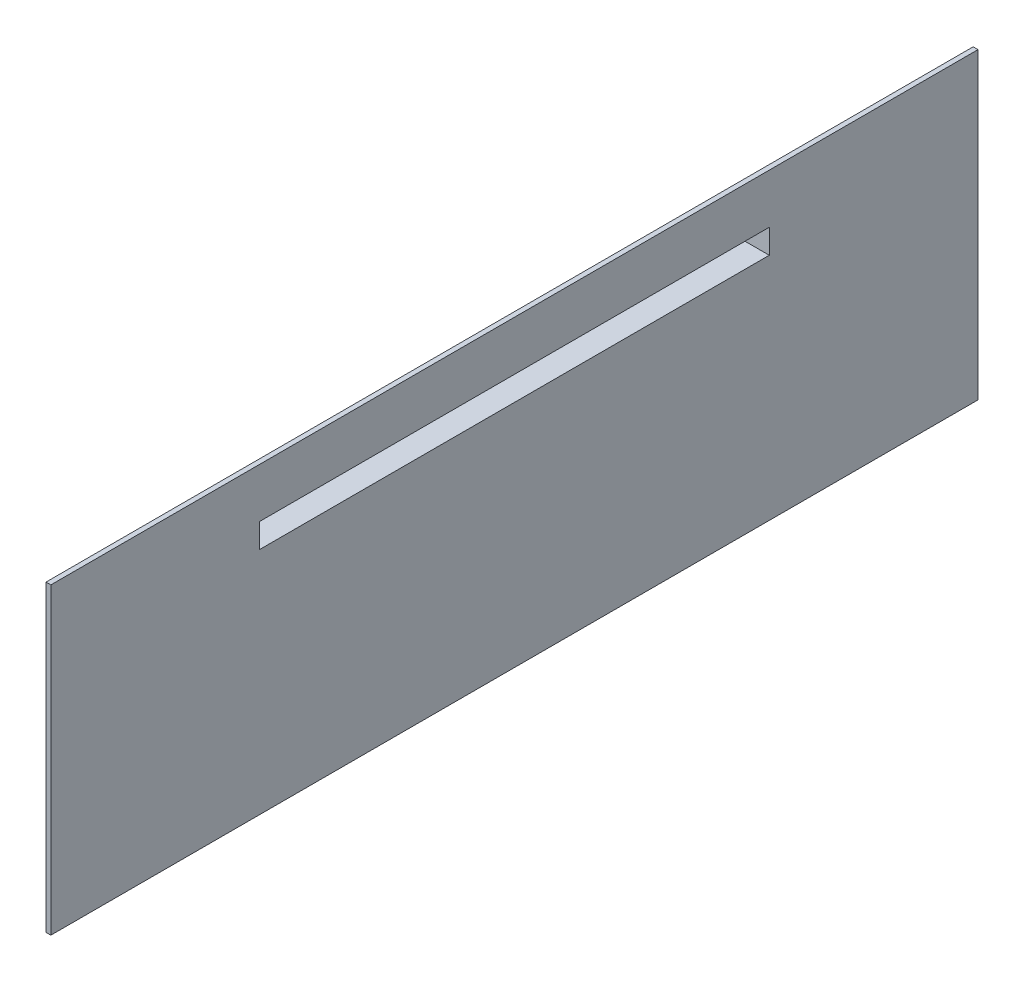
from build123d import *

# Parameters (mm, degrees)
SKETCH1_W           = 125
SKETCH1_H           = 382
BOSS_EXTRUDE1_DEPTH = 2
SKETCH2_W           = 216
SKETCH2_H           = 16
BOSS_EXTRUDE2_DEPTH = 10
SKETCH3_W           = 210
SKETCH3_H           = 10
CUT_EXTRUDE1_DEPTH  = 390.477855596


with BuildPart() as part:
    # Sketch1 → Boss-Extrude1 (new body)
    with BuildSketch(Plane(origin=(532, 0, 0), x_dir=(0, -1, 0), z_dir=(-1, 0, 0))):
        with Locations((12.5, -191)):
            Rectangle(SKETCH1_W, SKETCH1_H)
    extrude(amount=-BOSS_EXTRUDE1_DEPTH)

    # Sketch2 → Boss-Extrude2 (add)
    with BuildSketch(Plane.ZY.offset(-532)):
        with Locations((-191, 24.613657059)):
            Rectangle(SKETCH2_W, SKETCH2_H)
    extrude(amount=BOSS_EXTRUDE2_DEPTH)

    # Sketch3 → Cut-Extrude1 (cut, through all)
    with BuildSketch(Plane.ZY.offset(-522)):
        with Locations((-191, 24.613657059)):
            Rectangle(SKETCH3_W, SKETCH3_H)
    extrude(amount=-CUT_EXTRUDE1_DEPTH, mode=Mode.SUBTRACT)


solid = part.part
